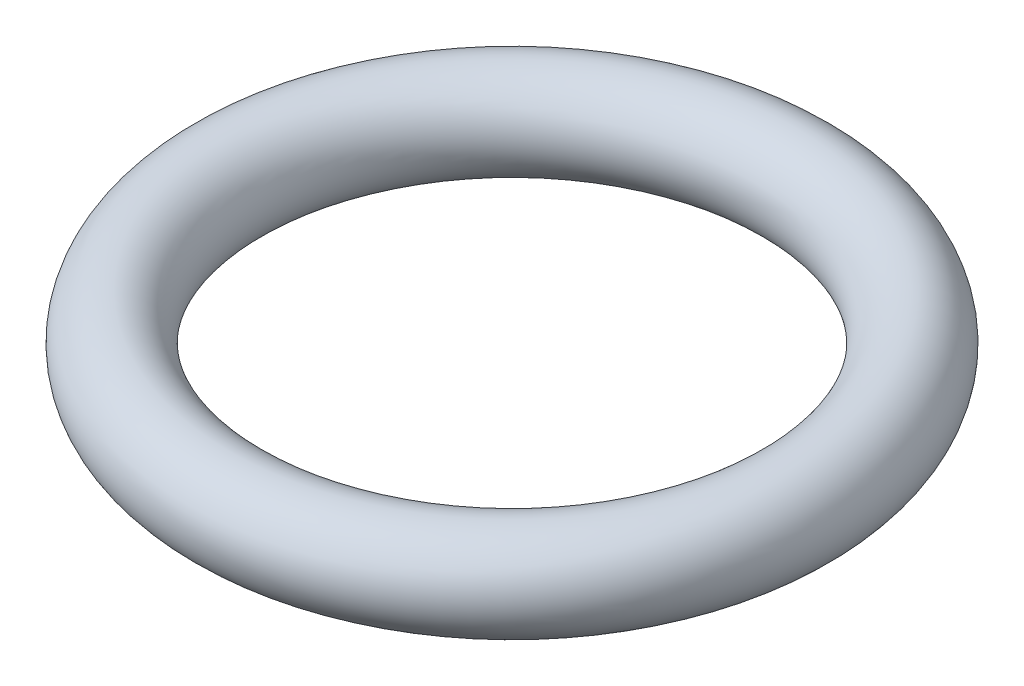
from build123d import *

# Parameters (mm, degrees)
SKETCH1_R = 2.5


with BuildPart() as part:
    # Sketch1 → Revolve1 (revolve)
    with BuildSketch(Plane.XY, mode=Mode.PRIVATE) as revolve1_sk:
        with Locations((15.25, 0)):
            Circle(SKETCH1_R)
    revolve(revolve1_sk.sketch.rotate(Axis((0, 33.380105018, 0), (0, -1, 0)), 90), axis=Axis((0, 33.380105018, 0), (0, -1, 0)))


solid = part.part
